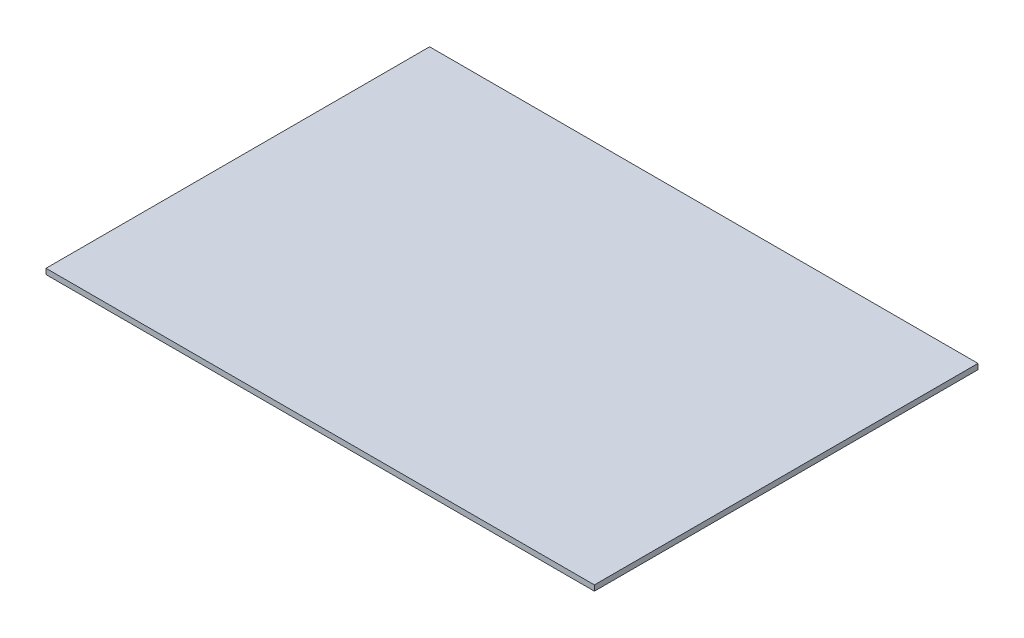
from build123d import *

# Parameters (mm, degrees)
CROQUIS1_W              = 448.4
CROQUIS1_H              = 698.4
SALIENTE_EXTRUIR1_DEPTH = 10


with BuildPart() as part:
    # Croquis1 → Saliente-Extruir1 (new body)
    with BuildSketch(Plane(origin=(0, 0, 0), x_dir=(1, 0, 0), z_dir=(0, 1, 0))):
        with Locations((-224.2, 0)):
            Rectangle(CROQUIS1_W, CROQUIS1_H)
        Polygon((550, 349.2), (0, 349.2), (0, -349.2), (550, -349.2), (550, -200), (550, -40), (550, 40), (550, 200), align=None)
    extrude(amount=SALIENTE_EXTRUIR1_DEPTH)


solid = part.part
